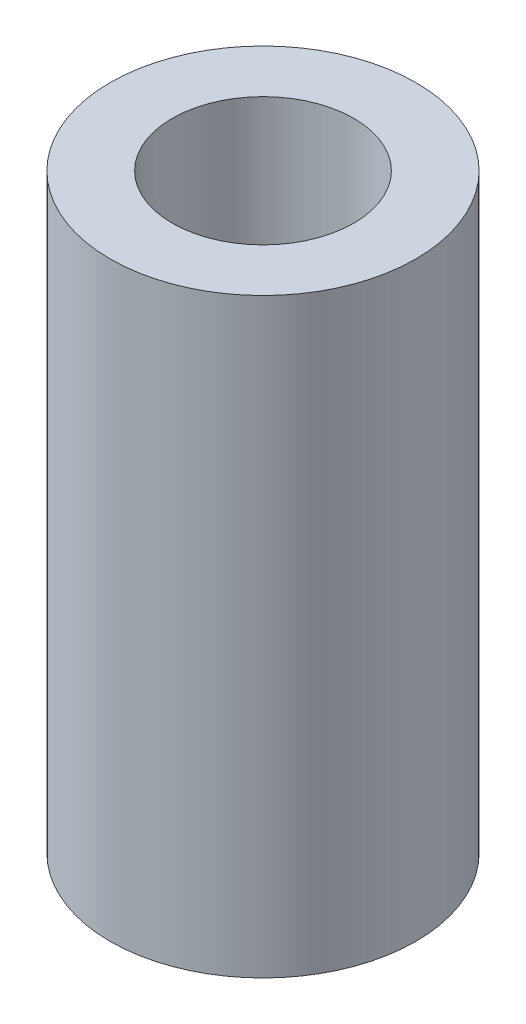
from build123d import *

# Parameters (mm, degrees)
SWEEP1_PROFILE_R     = 13.462
CUT_SWEEP1_PROFILE_R = 8.001


with BuildPart() as part:
    # Sweep1: sweep along a path in Sketch1
    with BuildLine(Plane.XY) as sweep1_path:
        Line((0, 0), (0, 52.07))
    # Sweep1 profile (on start of the path) → Sweep1 (sweep)
    with BuildSketch(Plane.ZX):
        Circle(SWEEP1_PROFILE_R)
    sweep(path=sweep1_path.line)

    # Cut-Sweep1: sweep along a path in Sketch1<2>
    with BuildLine(Plane.XY) as cut_sweep1_path:
        Line((0, 0), (0, 52.07))
    # Cut-Sweep1 profile (on start of the path) → Cut-Sweep1 (sweep, cut)
    with BuildSketch(Plane.ZX):
        Circle(CUT_SWEEP1_PROFILE_R)
    sweep(path=cut_sweep1_path.line, mode=Mode.SUBTRACT)


solid = part.part
